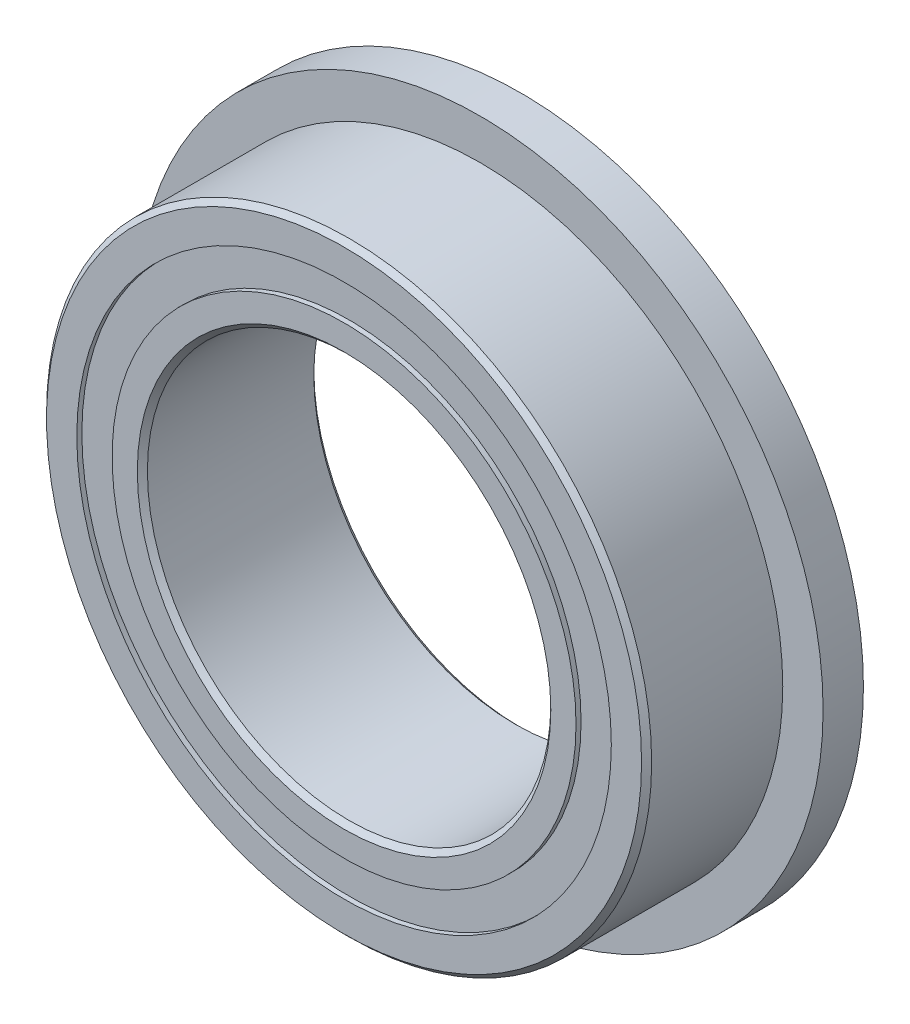
from build123d import *


with BuildPart() as part:
    # Sketch1 → Revolve1 (revolve)
    with BuildSketch(Plane(origin=(0, 0, 0), x_dir=(1, 0, 0), z_dir=(0, 1, 0))):
        Polygon((4, -1.65), (4.1, -1.75), (4.6, -1.75), (4.6, -1.65), (5.3, -1.65), (5.3, -1.75), (5.9, -1.75), (6, -1.65), (6, 0.95), (6.8, 0.95), (6.8, 1.75), (5.3, 1.75), (5.3, 1.65), (4.6, 1.65), (4.6, 1.75), (4.1, 1.75), (4, 1.65), align=None)
    revolve(axis=Axis((0, 0, -1.75), (0, 0, 1)))


solid = part.part
